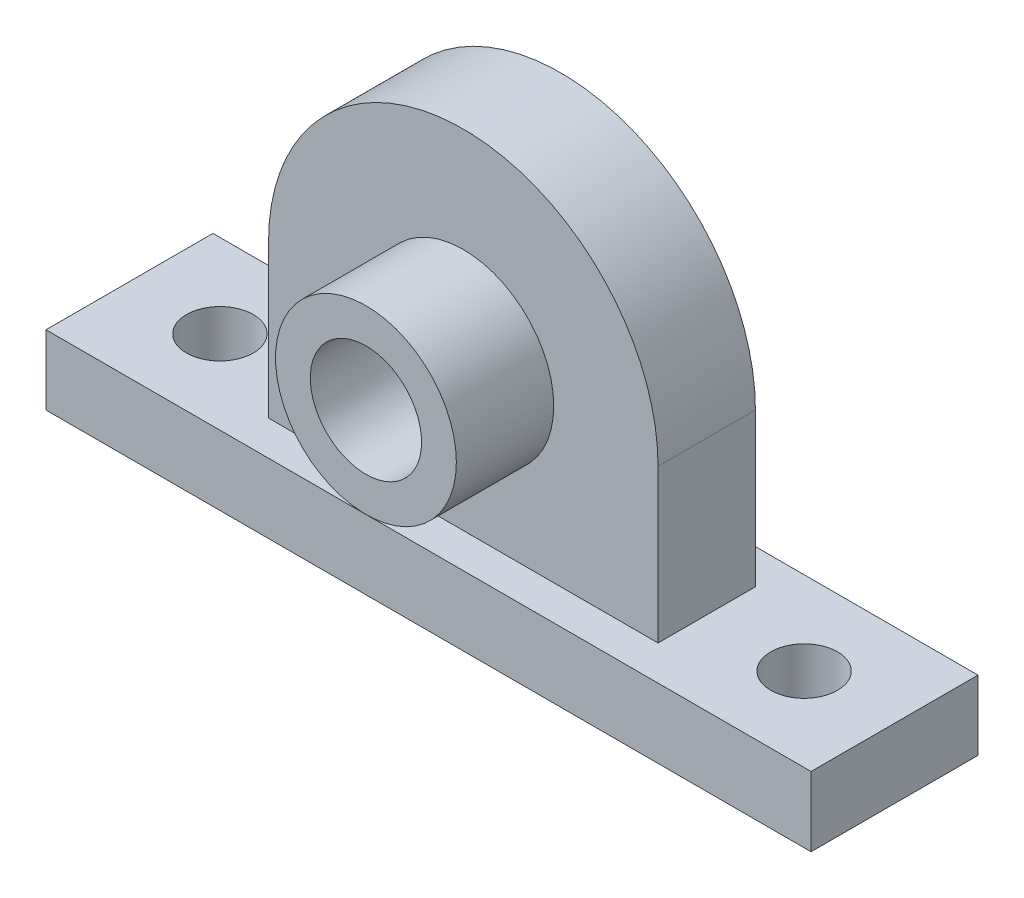
from build123d import *

# Parameters (mm, degrees)
BOSS_EXTRUDE1_DEPTH      = 6
SKETCH1_4_R              = 6.5
BOSS_EXTRUDE2_DEPTH      = 3.5
BOSS_EXTRUDE3_DEPTH      = 10.5
BOSS_EXTRUDE3_DEPTH_BACK = 3.5
SKETCH1_5_R              = 6.5
SKETCH1_5_R_2            = 4
CUT_EXTRUDE1_REACH       = 44.03
SKETCH2_R                = 2.4


with BuildPart() as part:
    # Sketch1 → Boss-Extrude1 (new, symmetric)
    with BuildSketch(Plane.XY):
        Polygon((-14, 2.5), (-27.5, 2.5), (-27.5, -2.5), (27.5, -2.5), (27.5, 2.5), (14, 2.5), (8.660254038, 2.5), (-8.660254038, 2.5), align=None)
    extrude(amount=BOSS_EXTRUDE1_DEPTH, both=True)

    # Sketch1<4> → Boss-Extrude2 (add, symmetric)
    with BuildSketch(Plane.XY):
        with BuildLine():
            Line((-14, 13.5), (-14, 2.5))
            Line((-14, 2.5), (14, 2.5))
            Line((14, 2.5), (14, 13.5))
            ThreePointArc((14, 13.5), (0, 27.5), (-14, 13.5))
        make_face()
        with Locations((0, 13.5)):
            Circle(SKETCH1_4_R, mode=Mode.SUBTRACT)
    extrude(amount=BOSS_EXTRUDE2_DEPTH, both=True)

    # Sketch1<5> → Boss-Extrude3 (add, two sides: drawn at the far end of the back side and taken through both)
    with BuildSketch(Plane.XY.offset(-BOSS_EXTRUDE3_DEPTH_BACK)):
        with Locations((0, 13.5)):
            Circle(SKETCH1_5_R)
        with Locations((0, 13.5)):
            Circle(SKETCH1_5_R_2, mode=Mode.SUBTRACT)
    extrude(amount=BOSS_EXTRUDE3_DEPTH + BOSS_EXTRUDE3_DEPTH_BACK)

    # Sketch2 → Cut-Extrude1 (cut, up to next)
    with BuildSketch(Plane.XZ.offset(2.5), mode=Mode.PRIVATE) as cut_extrude1_sk1:
        with Locations((21, 0)):
            Circle(SKETCH2_R)
    cut_extrude1_tool1 = extrude(cut_extrude1_sk1.sketch, amount=-CUT_EXTRUDE1_REACH, mode=Mode.PRIVATE) & part.part
    # Sketch2 → Cut-Extrude1 (cut, up to next)
    with BuildSketch(Plane.XZ.offset(2.5), mode=Mode.PRIVATE) as cut_extrude1_sk2:
        with Locations((-21, 0)):
            Circle(SKETCH2_R)
    cut_extrude1_tool2 = extrude(cut_extrude1_sk2.sketch, amount=-CUT_EXTRUDE1_REACH, mode=Mode.PRIVATE) & part.part
    add(cut_extrude1_tool1.solids().sort_by_distance((21, -2.5, 0))[0], mode=Mode.SUBTRACT)
    add(cut_extrude1_tool2.solids().sort_by_distance((-21, -2.5, 0))[0], mode=Mode.SUBTRACT)


solid = part.part
